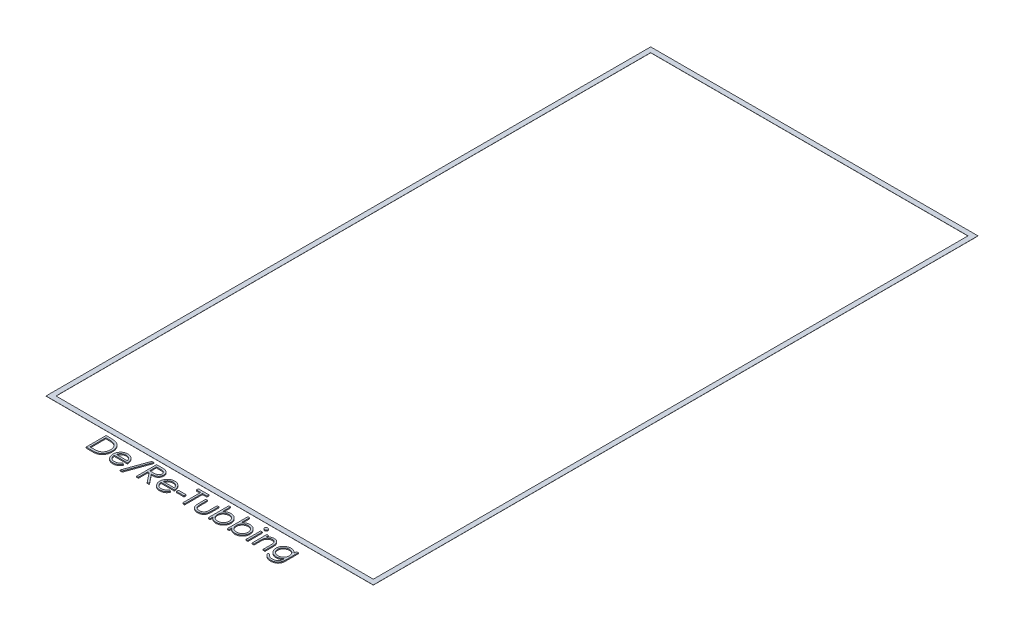
from build123d import *

# Parameters (mm, degrees)
SKETCH1_W              = 655
SKETCH1_H              = 1210
SKETCH1_W_2            = 635
SKETCH1_H_2            = 1190
BOSS_EXTRUDE1_DEPTH    = 0.3
BOSS_EXTRUDE3_DEPTH    = 2
BOSS_EXTRUDE3_2_DEPTH  = 2
BOSS_EXTRUDE3_3_DEPTH  = 2
BOSS_EXTRUDE3_4_DEPTH  = 2
BOSS_EXTRUDE3_5_DEPTH  = 2
SKETCH2_W              = 15.384615384
SKETCH2_H              = 4.102564103
BOSS_EXTRUDE3_6_DEPTH  = 2
BOSS_EXTRUDE3_7_DEPTH  = 2
BOSS_EXTRUDE3_8_DEPTH  = 2
BOSS_EXTRUDE3_9_DEPTH  = 2
BOSS_EXTRUDE3_10_DEPTH = 2
BOSS_EXTRUDE3_11_DEPTH = 2
SKETCH2_W_2            = 3.58974359
SKETCH2_H_2            = 29.23076923
BOSS_EXTRUDE3_12_DEPTH = 2
BOSS_EXTRUDE3_13_DEPTH = 2
BOSS_EXTRUDE3_14_DEPTH = 2


with BuildPart() as part:
    # Sketch1 → Boss-Extrude1 (new body)
    with BuildSketch(Plane(origin=(0, 0, 0), x_dir=(1, 0, 0), z_dir=(0, 1, 0))):
        with Locations((0.165510167, 0.165510167)):
            Rectangle(SKETCH1_W, SKETCH1_H)
        with Locations((0.165510167, 0.165510167)):
            Rectangle(SKETCH1_W_2, SKETCH1_H_2, mode=Mode.SUBTRACT)
    extrude(amount=BOSS_EXTRUDE1_DEPTH)


with BuildPart() as body_2:
    # Sketch2 → Boss-Extrude3 (new body)
    with BuildSketch(Plane(origin=(0, 0, 0), x_dir=(1, 0, 0), z_dir=(0, 1, 0))):
        with BuildLine():
            Line((-197.013977013, -654.834489833), (-197.013977013, -614.834489833))
            Line((-197.013977013, -614.834489833), (-188.937053936, -614.834489833))
            add(Edge.make_bspline(
                [(-188.937053936, -614.834489833), (-188.234551214, -614.839547776), (-186.87731961, -614.849319695), (-184.916034496, -614.911278451), (-183.101362925, -615.020883775), (-181.439273107, -615.180535502), (-179.925202113, -615.376570172), (-178.563389449, -615.622289079), (-177.34679353, -615.912439598), (-176.598571352, -616.159816172), (-176.244746244, -616.276797526)],
                knots=[0, 0, 0, 0, 1.314313732, 2.53924729, 3.670748893, 4.714932338, 5.66265055, 6.526160246, 7.303039223, 8, 8, 8, 8], degree=3))
            add(Edge.make_bspline(
                [(-176.244746244, -616.276797526), (-175.781949223, -616.453148447), (-174.866849883, -616.801851237), (-173.563911339, -617.459637538), (-172.337335762, -618.204930129), (-171.180545535, -619.038711417), (-170.119964662, -619.984589685), (-169.114160128, -621.00238495), (-168.20427757, -622.129108838), (-167.371039901, -623.341394415), (-166.619775222, -624.624960726), (-165.966756275, -625.977361968), (-165.424424922, -627.39173006), (-164.974216618, -628.864131752), (-164.619399961, -630.397804641), (-164.377320741, -631.994534539), (-164.217652286, -633.648010989), (-164.201605985, -634.77000486), (-164.193464192, -635.339297526)],
                knots=[0, 0, 0, 0, 0.984719456, 1.947108742, 2.898477687, 3.838006223, 4.779231079, 5.722358779, 6.681677486, 7.655904652, 8.64651281, 9.637519902, 10.640069247, 11.656948941, 12.698408672, 13.768548281, 14.867775369, 16, 16, 16, 16], degree=3))
            add(Edge.make_bspline(
                [(-164.193464192, -635.339297526), (-164.200652392, -635.83371168), (-164.214817491, -636.808006411), (-164.342009672, -638.24390236), (-164.526881901, -639.637200319), (-164.813101305, -640.981265462), (-165.160558601, -642.287873666), (-165.605863187, -643.543099316), (-166.115983144, -644.758457137), (-166.710838899, -645.917514005), (-167.363883299, -647.015609688), (-168.064703221, -648.050758581), (-168.812551168, -649.008189688), (-169.614558402, -649.890802397), (-170.460360875, -650.69726615), (-171.355496082, -651.434317754), (-172.302273805, -652.087535523), (-173.296453494, -652.682588189), (-174.367037827, -653.201677966), (-175.53430487, -653.640878078), (-176.803232618, -654.004839397), (-178.170706411, -654.308506777), (-179.639089014, -654.549390236), (-181.209820052, -654.710834721), (-182.88048622, -654.820011095), (-184.027677823, -654.829569876), (-184.61814368, -654.834489833)],
                knots=[0, 0, 0, 0, 1.105936401, 2.179363191, 3.223086493, 4.248585256, 5.251745608, 6.245858792, 7.225916811, 8.198733463, 9.158002045, 10.082870192, 10.993790845, 11.873723703, 12.748670949, 13.606408763, 14.465103618, 15.319838547, 16.196477973, 17.123216899, 18.106603292, 19.147568657, 20.255746949, 21.433717677, 22.679120308, 24, 24, 24, 24], degree=3))
            Line((-184.61814368, -654.834489833), (-197.013977013, -654.834489833))
        make_face()
        with BuildLine():
            Line((-193.424233423, -650.731925731), (-188.832887269, -650.731925731))
            add(Edge.make_bspline(
                [(-188.832887269, -650.731925731), (-188.173134461, -650.729090344), (-186.904188193, -650.723636856), (-185.079525367, -650.675783106), (-183.412332265, -650.597589534), (-181.902372157, -650.488160074), (-180.550497594, -650.3433759), (-179.353883309, -650.18194844), (-178.316451786, -649.980834717), (-177.688686792, -649.798538038), (-177.398592397, -649.714297526)],
                knots=[0, 0, 0, 0, 1.375205317, 2.645023457, 3.804390687, 4.853969522, 5.800190428, 6.637939096, 7.370582563, 8, 8, 8, 8], degree=3))
            add(Edge.make_bspline(
                [(-177.398592397, -649.714297526), (-177.033468259, -649.585708289), (-176.311940966, -649.331601166), (-175.273299992, -648.868085038), (-174.30464851, -648.319032812), (-173.389105364, -647.70872111), (-172.539657874, -647.015623944), (-171.746239401, -646.254812643), (-171.010447386, -645.422415214), (-170.339883866, -644.519464796), (-169.739788963, -643.551581417), (-169.22011777, -642.528280461), (-168.764671694, -641.460774058), (-168.407202064, -640.332669388), (-168.127023959, -639.154051577), (-167.928570383, -637.924837712), (-167.804973532, -636.645257348), (-167.790556984, -635.774947356), (-167.783207782, -635.331284705)],
                knots=[0, 0, 0, 0, 0.998632004, 1.973411704, 2.929992603, 3.868527914, 4.809262121, 5.754881198, 6.702106254, 7.672490631, 8.653608572, 9.636854334, 10.631411391, 11.644891563, 12.686317036, 13.754757253, 14.855430412, 16, 16, 16, 16], degree=3))
            add(Edge.make_bspline(
                [(-167.783207782, -635.331284705), (-167.789073923, -634.863473502), (-167.80059801, -633.944454252), (-167.945447272, -632.595989163), (-168.157122192, -631.299067443), (-168.463221461, -630.053602353), (-168.853288648, -628.857164042), (-169.340084553, -627.71636964), (-169.896274488, -626.619171138), (-170.558026909, -625.590892673), (-171.282776547, -624.618399997), (-172.087095168, -623.727486676), (-172.95820418, -622.916123244), (-173.88660246, -622.171673957), (-174.898455022, -621.524089089), (-175.969925774, -620.944812734), (-177.116733445, -620.453202547), (-177.914592826, -620.19172983), (-178.320066756, -620.058848808)],
                knots=[0, 0, 0, 0, 1.122418816, 2.205001699, 3.251619955, 4.274784885, 5.280384055, 6.268708349, 7.249350384, 8.229342522, 9.199999885, 10.157847722, 11.105861043, 12.055065948, 13.010012805, 13.98527497, 14.976112212, 16, 16, 16, 16], degree=3))
            add(Edge.make_bspline(
                [(-178.320066756, -620.058848808), (-178.655508429, -619.966089632), (-179.368749461, -619.768858174), (-180.53262905, -619.55371106), (-181.842516472, -619.363945357), (-183.304227342, -619.20328205), (-184.916095446, -619.087998377), (-186.679360451, -619.001469067), (-188.594784504, -618.943107553), (-189.92258489, -618.939122328), (-190.611733423, -618.937053936)],
                knots=[0, 0, 0, 0, 0.674548936, 1.434276114, 2.292660221, 3.240891867, 4.284742987, 5.42552168, 6.663806718, 8, 8, 8, 8], degree=3))
            Line((-190.611733423, -618.937053936), (-193.424233423, -618.937053936))
            Line((-193.424233423, -618.937053936), (-193.424233423, -650.731925731))
        make_face(mode=Mode.SUBTRACT)
    extrude(amount=BOSS_EXTRUDE3_DEPTH)


with BuildPart() as body_3:
    # Sketch2 → Boss-Extrude3 2 (new body)
    with BuildSketch(Plane(origin=(0, 0, 0), x_dir=(1, 0, 0), z_dir=(0, 1, 0))):
        with BuildLine():
            Line((-133.023592397, -645.603720603), (-129.834489833, -647.27840009))
            add(Edge.make_bspline(
                [(-129.834489833, -647.27840009), (-130.08862235, -647.729181019), (-130.58306359, -648.606222194), (-131.433357852, -649.811157742), (-132.324695824, -650.895131637), (-133.297312601, -651.829184829), (-134.322108932, -652.643486372), (-135.404767844, -653.355918654), (-136.550925761, -653.962987458), (-137.760636901, -654.474444919), (-139.044060343, -654.867696281), (-140.404306245, -655.145458806), (-141.843980478, -655.317153304), (-142.830793962, -655.33709777), (-143.336092397, -655.347310346)],
                knots=[0, 0, 0, 0, 1.120438281, 2.179929193, 3.190490725, 4.156257408, 5.095198341, 6.022838206, 6.959905092, 7.901321166, 8.864066838, 9.862729781, 10.905609505, 12, 12, 12, 12], degree=3))
            add(Edge.make_bspline(
                [(-143.336092397, -655.347310346), (-143.897714998, -655.334199771), (-144.993277988, -655.308624837), (-146.588017955, -655.088139529), (-148.089497023, -654.72845543), (-149.497630775, -654.225992098), (-150.808970805, -653.569679823), (-152.026123431, -652.770142888), (-153.155489441, -651.831488549), (-154.161480403, -650.745586338), (-155.067124777, -649.583506826), (-155.866277005, -648.372582432), (-156.534361932, -647.115859866), (-157.077820334, -645.821339591), (-157.516733076, -644.497180808), (-157.822638262, -643.131335464), (-157.998978239, -641.727500216), (-158.026000474, -640.777816379), (-158.039618038, -640.299233423)],
                knots=[0, 0, 0, 0, 1.145258523, 2.234067595, 3.276747158, 4.290159414, 5.277019952, 6.260822364, 7.254936242, 8.264827045, 9.274100331, 10.257902744, 11.220704747, 12.172965371, 13.118907548, 14.062713208, 15.023725156, 16, 16, 16, 16], degree=3))
            add(Edge.make_bspline(
                [(-158.039618038, -640.299233423), (-158.027513566, -639.850149647), (-158.0035241, -638.960124908), (-157.852315102, -637.642804399), (-157.584334609, -636.362479227), (-157.216605193, -635.118085536), (-156.741733808, -633.911706862), (-156.16079416, -632.742608992), (-155.472881271, -631.612035965), (-154.941764999, -630.898857294), (-154.674233423, -630.539618038)],
                knots=[0, 0, 0, 0, 1.024358464, 2.0301432, 3.019427413, 4.004406732, 4.986367066, 5.972626655, 6.978780325, 8, 8, 8, 8], degree=3))
            add(Edge.make_bspline(
                [(-154.674233423, -630.539618038), (-154.311859906, -630.106830952), (-153.598591944, -629.254966375), (-152.392233598, -628.135671223), (-151.085945639, -627.198028079), (-149.696098484, -626.420803666), (-148.20653878, -625.8302477), (-146.63728974, -625.390161046), (-144.97048304, -625.143555205), (-143.830994802, -625.108722821), (-143.247951372, -625.09090009)],
                knots=[0, 0, 0, 0, 1.030682036, 2.02871468, 2.997146059, 3.962720338, 4.930598197, 5.918074684, 6.934738563, 8, 8, 8, 8], degree=3))
            add(Edge.make_bspline(
                [(-143.247951372, -625.09090009), (-142.648550168, -625.106374934), (-141.472661643, -625.136733052), (-139.758008831, -625.418176862), (-138.135600642, -625.864491771), (-136.606086307, -626.494820806), (-135.169310756, -627.308072826), (-133.834613047, -628.315408157), (-132.579167189, -629.485900583), (-131.848783431, -630.386051548), (-131.477118038, -630.844105218)],
                knots=[0, 0, 0, 0, 1.056321875, 2.072262726, 3.055038591, 4.01806755, 4.982017516, 5.957941055, 6.960871419, 8, 8, 8, 8], degree=3))
            add(Edge.make_bspline(
                [(-131.477118038, -630.844105218), (-131.224238743, -631.189289005), (-130.720163394, -631.877358933), (-130.088767965, -632.999315014), (-129.540683451, -634.173150378), (-129.102592468, -635.417839488), (-128.747855311, -636.71863469), (-128.491205954, -638.084835201), (-128.340696027, -639.516034188), (-128.311110915, -640.491194822), (-128.296028295, -640.988335987)],
                knots=[0, 0, 0, 0, 0.94817472, 1.890038105, 2.849395472, 3.817997239, 4.812318967, 5.836947057, 6.897266129, 8, 8, 8, 8], degree=3))
            Line((-128.296028295, -640.988335987), (-154.449874449, -640.988335987))
            add(Edge.make_bspline(
                [(-154.449874449, -640.988335987), (-154.432278947, -641.37348415), (-154.397678102, -642.130862479), (-154.23636218, -643.2391), (-153.982090479, -644.294795339), (-153.624729764, -645.290030104), (-153.191965818, -646.23780299), (-152.66184334, -647.131083412), (-152.029391295, -647.965802613), (-151.323954731, -648.749427043), (-150.538730784, -649.447264313), (-149.712642244, -650.071856041), (-148.833858644, -650.595348575), (-147.909309119, -651.020261601), (-146.940488717, -651.352905213), (-145.927092201, -651.579966021), (-144.871113729, -651.732047243), (-144.151276768, -651.748957702), (-143.784810346, -651.757566756)],
                knots=[0, 0, 0, 0, 1.094153842, 2.151609401, 3.174256925, 4.172055639, 5.149267565, 6.128595816, 7.11444997, 8.118368179, 9.117203808, 10.09244225, 11.054858984, 12.015122123, 12.976791628, 13.957293641, 14.960065497, 16, 16, 16, 16], degree=3))
            add(Edge.make_bspline(
                [(-143.784810346, -651.757566756), (-143.426511516, -651.750617537), (-142.715577906, -651.736828954), (-141.65682525, -651.602749972), (-140.615230652, -651.385946822), (-139.595105129, -651.090061221), (-138.617152604, -650.729182911), (-137.711489175, -650.293721681), (-136.878572425, -649.81201029), (-136.100092806, -649.261042575), (-135.34499574, -648.586663295), (-134.595938752, -647.745112198), (-133.792776999, -646.749826166), (-133.290038796, -646.000732841), (-133.023592397, -645.603720603)],
                knots=[0, 0, 0, 0, 0.99110716, 1.966546729, 2.947904876, 3.932708344, 4.903319531, 5.828989031, 6.710028674, 7.56322171, 8.463672341, 9.504779593, 10.677557249, 12, 12, 12, 12], degree=3))
        make_face()
        with BuildLine():
            add(Edge.make_bspline(
                [(-131.885771885, -637.398592397), (-132.01716188, -636.922445269), (-132.270045325, -636.00601532), (-132.798460919, -634.736976572), (-133.393564241, -633.609114846), (-134.0978126, -632.631061897), (-134.895740892, -631.76245032), (-135.817400123, -631.003380775), (-136.850953191, -630.324324191), (-137.991057656, -629.751152769), (-139.198392343, -629.263268669), (-140.462463108, -628.936124489), (-141.752266398, -628.712015434), (-142.624658242, -628.691145624), (-143.0636565, -628.68064368)],
                knots=[0, 0, 0, 0, 1.154881502, 2.222775134, 3.210006277, 4.132804581, 5.035138423, 5.962687519, 6.919655026, 7.923214229, 8.944639381, 9.960483929, 10.97369054, 12, 12, 12, 12], degree=3))
            add(Edge.make_bspline(
                [(-143.0636565, -628.68064368), (-143.421935797, -628.687634211), (-144.130178644, -628.701453023), (-145.173619423, -628.832540216), (-146.175673125, -629.049224157), (-147.143733555, -629.345966518), (-148.065114908, -629.741493404), (-148.958769402, -630.205301708), (-149.80197393, -630.771491237), (-150.329303021, -631.203021007), (-150.595707782, -631.421028295)],
                knots=[0, 0, 0, 0, 1.04873581, 2.073130211, 3.073294108, 4.04793562, 5.032784715, 6.005352987, 6.992311501, 8, 8, 8, 8], degree=3))
            add(Edge.make_bspline(
                [(-150.595707782, -631.421028295), (-150.786488147, -631.593534759), (-151.17258111, -631.9426458), (-151.688472784, -632.544122446), (-152.182421043, -633.192711728), (-152.631948503, -633.913227438), (-153.044263777, -634.697464912), (-153.430092088, -635.538809315), (-153.777365369, -636.443645089), (-153.972749484, -637.074187252), (-154.073271885, -637.398592397)],
                knots=[0, 0, 0, 0, 0.879870761, 1.780643979, 2.707998968, 3.669668524, 4.684282772, 5.740141944, 6.837334558, 8, 8, 8, 8], degree=3))
            Line((-154.073271885, -637.398592397), (-131.885771885, -637.398592397))
        make_face(mode=Mode.SUBTRACT)
    extrude(amount=BOSS_EXTRUDE3_2_DEPTH)


with BuildPart() as body_4:
    # Sketch2 → Boss-Extrude3 3 (new body)
    with BuildSketch(Plane(origin=(0, 0, 0), x_dir=(1, 0, 0), z_dir=(0, 1, 0))):
        Polygon((-102.655002654, -613.808848808), (-119.385771885, -660.475515474), (-123.167823167, -660.475515474), (-106.437053936, -613.808848808), align=None)
    extrude(amount=BOSS_EXTRUDE3_3_DEPTH)


with BuildPart() as body_5:
    # Sketch2 → Boss-Extrude3 4 (new body)
    with BuildSketch(Plane(origin=(0, 0, 0), x_dir=(1, 0, 0), z_dir=(0, 1, 0))):
        with BuildLine():
            Line((-95.988335987, -614.834489833), (-87.983528295, -614.834489833))
            add(Edge.make_bspline(
                [(-87.983528295, -614.834489833), (-87.449343969, -614.836267959), (-86.42365089, -614.839682157), (-84.954242086, -614.858719447), (-83.619075263, -614.913283513), (-82.418848528, -614.960238752), (-81.3535839, -615.045860939), (-80.420014863, -615.127696906), (-79.622441177, -615.234824458), (-79.139631448, -615.334315006), (-78.921028295, -615.379361628)],
                knots=[0, 0, 0, 0, 1.410062039, 2.707475311, 3.878576406, 4.937260626, 5.877586885, 6.699081471, 7.410979367, 8, 8, 8, 8], degree=3))
            add(Edge.make_bspline(
                [(-78.921028295, -615.379361628), (-78.628381162, -615.451667518), (-78.049329854, -615.594736817), (-77.215614813, -615.897132255), (-76.421165397, -616.247070822), (-75.66928169, -616.658084769), (-74.963729791, -617.133225108), (-74.29723481, -617.664289364), (-73.666772372, -618.248371716), (-73.097839455, -618.900198476), (-72.56139315, -619.584044301), (-72.108951704, -620.323515807), (-71.718934793, -621.096790408), (-71.408414599, -621.911732325), (-71.158380617, -622.760438289), (-70.982080738, -623.650595966), (-70.876352879, -624.578149967), (-70.865588816, -625.210811782), (-70.860130859, -625.531605218)],
                knots=[0, 0, 0, 0, 1.027469482, 2.033020251, 3.019912614, 3.986113645, 4.951240523, 5.91722682, 6.890402269, 7.87763091, 8.8651537, 9.85103654, 10.82876324, 11.815024772, 12.821070561, 13.842952187, 14.906261191, 16, 16, 16, 16], degree=3))
            add(Edge.make_bspline(
                [(-70.860130859, -625.531605218), (-70.876919409, -626.064577842), (-70.909678218, -627.104545475), (-71.215107974, -628.613812691), (-71.715411057, -630.021690573), (-72.404820074, -631.326406435), (-73.282756939, -632.502528096), (-74.337897409, -633.535561871), (-75.570830112, -634.400018015), (-76.718593723, -634.99947864), (-77.732470291, -635.383397596), (-78.567136722, -635.653527411), (-79.477616465, -635.862235586), (-80.455186004, -636.04920852), (-81.503913495, -636.190370742), (-82.621285374, -636.293760393), (-83.808098535, -636.358378093), (-84.623402185, -636.368001006), (-85.042823167, -636.372951372)],
                knots=[0, 0, 0, 0, 1.260483769, 2.459530307, 3.627416485, 4.787058657, 5.939039949, 7.08810263, 8.267026773, 9.491475466, 10.141966685, 10.831826277, 11.566392101, 12.351337768, 13.187381173, 14.07005841, 15.007169909, 16, 16, 16, 16], degree=3))
            Line((-85.042823167, -636.372951372), (-70.347310346, -654.834489833))
            Line((-70.347310346, -654.834489833), (-74.78641291, -654.834489833))
            Line((-74.78641291, -654.834489833), (-89.481925731, -636.372951372))
            Line((-89.481925731, -636.372951372), (-92.398592397, -636.372951372))
            Line((-92.398592397, -636.372951372), (-92.398592397, -654.834489833))
            Line((-92.398592397, -654.834489833), (-95.988335987, -654.834489833))
            Line((-95.988335987, -654.834489833), (-95.988335987, -614.834489833))
        make_face()
        with BuildLine():
            Line((-92.398592397, -618.937053936), (-92.398592397, -632.270387269))
            Line((-92.398592397, -632.270387269), (-85.074874449, -632.326477013))
            add(Edge.make_bspline(
                [(-85.074874449, -632.326477013), (-84.732931147, -632.326628289), (-84.070147637, -632.326921505), (-83.111282896, -632.281278348), (-82.21848162, -632.229354711), (-81.395158738, -632.149933619), (-80.640946448, -632.047578514), (-79.956221726, -631.919544408), (-79.339866847, -631.770377978), (-78.621026408, -631.539502254), (-77.818323192, -631.173719188), (-76.945963651, -630.64154206), (-76.203079791, -629.972180698), (-75.575447079, -629.206769772), (-75.071110719, -628.365212643), (-74.715544384, -627.457596995), (-74.489916472, -626.506835874), (-74.463304524, -625.853371785), (-74.449874449, -625.523592397)],
                knots=[0, 0, 0, 0, 1.146690395, 2.22261258, 3.21895312, 4.145990853, 4.996080663, 5.770904154, 6.481378293, 7.121626537, 8.300444488, 9.431385265, 10.535395872, 11.636531494, 12.74115979, 13.810798291, 14.895190096, 16, 16, 16, 16], degree=3))
            add(Edge.make_bspline(
                [(-74.449874449, -625.523592397), (-74.463612975, -625.201917269), (-74.490837722, -624.564474541), (-74.713109363, -623.631264138), (-75.088988007, -622.750498994), (-75.595527869, -621.925762022), (-76.212661068, -621.177125041), (-76.936293213, -620.536586149), (-77.746638301, -620.008020839), (-78.504023425, -619.67025649), (-79.180985853, -619.463172453), (-79.768753397, -619.317444866), (-80.432884571, -619.200365221), (-81.176604098, -619.106558811), (-81.996737021, -619.025930877), (-82.897430176, -618.971624835), (-83.872707665, -618.939466388), (-84.548672593, -618.937876801), (-84.898592397, -618.937053936)],
                knots=[0, 0, 0, 0, 1.101028733, 2.181837193, 3.264309656, 4.369019818, 5.486613113, 6.575447106, 7.666700264, 8.788928104, 9.402425223, 10.0903467, 10.862060571, 11.710948788, 12.657782767, 13.684531032, 14.801375019, 16, 16, 16, 16], degree=3))
            Line((-84.898592397, -618.937053936), (-92.398592397, -618.937053936))
        make_face(mode=Mode.SUBTRACT)
    extrude(amount=BOSS_EXTRUDE3_4_DEPTH)


with BuildPart() as body_6:
    # Sketch2 → Boss-Extrude3 5 (new body)
    with BuildSketch(Plane(origin=(0, 0, 0), x_dir=(1, 0, 0), z_dir=(0, 1, 0))):
        with BuildLine():
            Line((-39.177438551, -645.603720603), (-35.988335987, -647.27840009))
            add(Edge.make_bspline(
                [(-35.988335987, -647.27840009), (-36.242468504, -647.729181019), (-36.736909744, -648.606222194), (-37.587204006, -649.811157742), (-38.478541978, -650.895131637), (-39.451158755, -651.829184829), (-40.475955086, -652.643486372), (-41.558613998, -653.355918654), (-42.704771915, -653.962987458), (-43.914483055, -654.474444919), (-45.197906497, -654.867696281), (-46.558152399, -655.145458806), (-47.997826632, -655.317153304), (-48.984640116, -655.33709777), (-49.489938551, -655.347310346)],
                knots=[0, 0, 0, 0, 1.120438281, 2.179929193, 3.190490725, 4.156257408, 5.095198341, 6.022838206, 6.959905092, 7.901321166, 8.864066838, 9.862729781, 10.905609505, 12, 12, 12, 12], degree=3))
            add(Edge.make_bspline(
                [(-49.489938551, -655.347310346), (-50.051561152, -655.334199771), (-51.147124142, -655.308624837), (-52.741864109, -655.088139529), (-54.243343176, -654.72845543), (-55.651476929, -654.225992098), (-56.962816959, -653.569679823), (-58.179969585, -652.770142888), (-59.309335595, -651.831488549), (-60.315326557, -650.745586338), (-61.220970931, -649.583506826), (-62.020123159, -648.372582432), (-62.688208085, -647.115859866), (-63.231666488, -645.821339591), (-63.67057923, -644.497180808), (-63.976484416, -643.131335464), (-64.152824393, -641.727500216), (-64.179846628, -640.777816379), (-64.193464192, -640.299233423)],
                knots=[0, 0, 0, 0, 1.145258523, 2.234067595, 3.276747158, 4.290159414, 5.277019952, 6.260822364, 7.254936242, 8.264827045, 9.274100331, 10.257902744, 11.220704747, 12.172965371, 13.118907548, 14.062713208, 15.023725156, 16, 16, 16, 16], degree=3))
            add(Edge.make_bspline(
                [(-64.193464192, -640.299233423), (-64.18135972, -639.850149647), (-64.157370254, -638.960124908), (-64.006161255, -637.642804399), (-63.738180763, -636.362479227), (-63.370451347, -635.118085536), (-62.895579962, -633.911706862), (-62.314640314, -632.742608992), (-61.626727425, -631.612035965), (-61.095611153, -630.898857294), (-60.828079577, -630.539618038)],
                knots=[0, 0, 0, 0, 1.024358464, 2.0301432, 3.019427413, 4.004406732, 4.986367066, 5.972626655, 6.978780325, 8, 8, 8, 8], degree=3))
            add(Edge.make_bspline(
                [(-60.828079577, -630.539618038), (-60.46570606, -630.106830952), (-59.752438098, -629.254966375), (-58.546079751, -628.135671223), (-57.239791793, -627.198028079), (-55.849944638, -626.420803666), (-54.360384934, -625.8302477), (-52.791135894, -625.390161046), (-51.124329194, -625.143555205), (-49.984840956, -625.108722821), (-49.401797526, -625.09090009)],
                knots=[0, 0, 0, 0, 1.030682036, 2.02871468, 2.997146059, 3.962720338, 4.930598197, 5.918074684, 6.934738563, 8, 8, 8, 8], degree=3))
            add(Edge.make_bspline(
                [(-49.401797526, -625.09090009), (-48.802396322, -625.106374934), (-47.626507797, -625.136733052), (-45.911854985, -625.418176862), (-44.289446796, -625.864491771), (-42.759932461, -626.494820806), (-41.32315691, -627.308072826), (-39.9884592, -628.315408157), (-38.733013343, -629.485900583), (-38.002629584, -630.386051548), (-37.630964192, -630.844105218)],
                knots=[0, 0, 0, 0, 1.056321875, 2.072262726, 3.055038591, 4.01806755, 4.982017516, 5.957941055, 6.960871419, 8, 8, 8, 8], degree=3))
            add(Edge.make_bspline(
                [(-37.630964192, -630.844105218), (-37.378084897, -631.189289005), (-36.874009548, -631.877358933), (-36.242614119, -632.999315014), (-35.694529605, -634.173150378), (-35.256438622, -635.417839488), (-34.901701465, -636.71863469), (-34.645052108, -638.084835201), (-34.494542181, -639.516034188), (-34.464957069, -640.491194822), (-34.449874449, -640.988335987)],
                knots=[0, 0, 0, 0, 0.94817472, 1.890038105, 2.849395472, 3.817997239, 4.812318967, 5.836947057, 6.897266129, 8, 8, 8, 8], degree=3))
            Line((-34.449874449, -640.988335987), (-60.603720603, -640.988335987))
            add(Edge.make_bspline(
                [(-60.603720603, -640.988335987), (-60.586125101, -641.37348415), (-60.551524255, -642.130862479), (-60.390208334, -643.2391), (-60.135936633, -644.294795339), (-59.778575917, -645.290030104), (-59.345811972, -646.23780299), (-58.815689494, -647.131083412), (-58.183237449, -647.965802613), (-57.477800884, -648.749427043), (-56.692576938, -649.447264313), (-55.866488398, -650.071856041), (-54.987704798, -650.595348575), (-54.063155273, -651.020261601), (-53.094334871, -651.352905213), (-52.080938355, -651.579966021), (-51.024959883, -651.732047243), (-50.305122922, -651.748957702), (-49.9386565, -651.757566756)],
                knots=[0, 0, 0, 0, 1.094153842, 2.151609401, 3.174256925, 4.172055639, 5.149267565, 6.128595816, 7.11444997, 8.118368179, 9.117203808, 10.09244225, 11.054858984, 12.015122123, 12.976791628, 13.957293641, 14.960065497, 16, 16, 16, 16], degree=3))
            add(Edge.make_bspline(
                [(-49.9386565, -651.757566756), (-49.58035767, -651.750617537), (-48.86942406, -651.736828954), (-47.810671404, -651.602749972), (-46.769076805, -651.385946822), (-45.748951282, -651.090061221), (-44.770998758, -650.729182911), (-43.865335328, -650.293721681), (-43.032418578, -649.81201029), (-42.25393896, -649.261042575), (-41.498841893, -648.586663295), (-40.749784906, -647.745112198), (-39.946623153, -646.749826166), (-39.44388495, -646.000732841), (-39.177438551, -645.603720603)],
                knots=[0, 0, 0, 0, 0.99110716, 1.966546729, 2.947904876, 3.932708344, 4.903319531, 5.828989031, 6.710028674, 7.56322171, 8.463672341, 9.504779593, 10.677557249, 12, 12, 12, 12], degree=3))
        make_face()
        with BuildLine():
            add(Edge.make_bspline(
                [(-38.039618038, -637.398592397), (-38.171008033, -636.922445269), (-38.423891479, -636.00601532), (-38.952307073, -634.736976572), (-39.547410395, -633.609114846), (-40.251658753, -632.631061897), (-41.049587046, -631.76245032), (-41.971246277, -631.003380775), (-43.004799345, -630.324324191), (-44.14490381, -629.751152769), (-45.352238497, -629.263268669), (-46.616309262, -628.936124489), (-47.906112552, -628.712015434), (-48.778504396, -628.691145624), (-49.217502654, -628.68064368)],
                knots=[0, 0, 0, 0, 1.154881502, 2.222775134, 3.210006277, 4.132804581, 5.035138423, 5.962687519, 6.919655026, 7.923214229, 8.944639381, 9.960483929, 10.97369054, 12, 12, 12, 12], degree=3))
            add(Edge.make_bspline(
                [(-49.217502654, -628.68064368), (-49.575781951, -628.687634211), (-50.284024798, -628.701453023), (-51.327465577, -628.832540216), (-52.329519279, -629.049224157), (-53.297579709, -629.345966518), (-54.218961061, -629.741493404), (-55.112615555, -630.205301708), (-55.955820084, -630.771491237), (-56.483149175, -631.203021007), (-56.749553936, -631.421028295)],
                knots=[0, 0, 0, 0, 1.04873581, 2.073130211, 3.073294108, 4.04793562, 5.032784715, 6.005352987, 6.992311501, 8, 8, 8, 8], degree=3))
            add(Edge.make_bspline(
                [(-56.749553936, -631.421028295), (-56.940334301, -631.593534759), (-57.326427264, -631.9426458), (-57.842318938, -632.544122446), (-58.336267197, -633.192711728), (-58.785794657, -633.913227438), (-59.198109931, -634.697464912), (-59.583938242, -635.538809315), (-59.931211523, -636.443645089), (-60.126595637, -637.074187252), (-60.227118038, -637.398592397)],
                knots=[0, 0, 0, 0, 0.879870761, 1.780643979, 2.707998968, 3.669668524, 4.684282772, 5.740141944, 6.837334558, 8, 8, 8, 8], degree=3))
            Line((-60.227118038, -637.398592397), (-38.039618038, -637.398592397))
        make_face(mode=Mode.SUBTRACT)
    extrude(amount=BOSS_EXTRUDE3_5_DEPTH)


with BuildPart() as body_7:
    # Sketch2 → Boss-Extrude3 6 (new body)
    with BuildSketch(Plane(origin=(0, 0, 0), x_dir=(1, 0, 0), z_dir=(0, 1, 0))):
        with Locations((-22.142182141, -639.449874449)):
            Rectangle(SKETCH2_W, SKETCH2_H)
    extrude(amount=BOSS_EXTRUDE3_6_DEPTH)


with BuildPart() as body_8:
    # Sketch2 → Boss-Extrude3 7 (new body)
    with BuildSketch(Plane(origin=(0, 0, 0), x_dir=(1, 0, 0), z_dir=(0, 1, 0))):
        Polygon((-12.398592397, -618.937053936), (-12.398592397, -614.834489833), (8.627048628, -614.834489833), (8.627048628, -618.937053936), (-0.09090009, -618.937053936), (-0.09090009, -654.834489833), (-3.68064368, -654.834489833), (-3.68064368, -618.937053936), align=None)
    extrude(amount=BOSS_EXTRUDE3_7_DEPTH)


with BuildPart() as body_9:
    # Sketch2 → Boss-Extrude3 8 (new body)
    with BuildSketch(Plane(origin=(0, 0, 0), x_dir=(1, 0, 0), z_dir=(0, 1, 0))):
        with BuildLine():
            Line((13.242433244, -625.603720603), (16.832176833, -625.603720603))
            Line((16.832176833, -625.603720603), (16.832176833, -639.16141291))
            add(Edge.make_bspline(
                [(16.832176833, -639.16141291), (16.833798604, -639.559387187), (16.836900974, -640.320693336), (16.857940299, -641.416181184), (16.907427084, -642.415229329), (16.969299364, -643.318414892), (17.048866634, -644.125585081), (17.143533611, -644.83392059), (17.249344144, -645.451454123), (17.352918017, -645.823378188), (17.40108709, -645.996348808)],
                knots=[0, 0, 0, 0, 1.388932606, 2.656963016, 3.823490214, 4.879454478, 5.816252168, 6.653371382, 7.373723809, 8, 8, 8, 8], degree=3))
            add(Edge.make_bspline(
                [(17.40108709, -645.996348808), (17.478360861, -646.213753047), (17.631301901, -646.644041746), (17.908713144, -647.265630376), (18.251894134, -647.84134789), (18.627435024, -648.393394435), (19.060571111, -648.905417142), (19.545822209, -649.376551356), (20.066944918, -649.824598113), (20.841288042, -650.354710021), (21.900251082, -650.922885223), (23.290568286, -651.413123147), (24.798045153, -651.706103947), (25.839927659, -651.740095433), (26.375446064, -651.757566756)],
                knots=[0, 0, 0, 0, 0.725840625, 1.436591201, 2.137033971, 2.831655856, 3.53531722, 4.242432219, 4.957935707, 5.694543706, 7.190802206, 8.724350549, 10.316345118, 12, 12, 12, 12], degree=3))
            add(Edge.make_bspline(
                [(26.375446064, -651.757566756), (26.910914724, -651.739723915), (27.946947504, -651.705201319), (29.437861439, -651.421960878), (30.800734747, -650.948753003), (32.021888476, -650.288096869), (33.095783792, -649.479616151), (33.990691435, -648.530944051), (34.729060058, -647.472093915), (35.051453437, -646.682102157), (35.21358709, -646.284810346)],
                knots=[0, 0, 0, 0, 1.157059328, 2.238695713, 3.266970494, 4.264342957, 5.228770407, 6.160125903, 7.074715775, 8, 8, 8, 8], degree=3))
            add(Edge.make_bspline(
                [(35.21358709, -646.284810346), (35.261521148, -646.125195504), (35.367491643, -645.772326071), (35.481347089, -645.173700375), (35.583912364, -644.45981918), (35.67149152, -643.626011081), (35.733950521, -642.674455053), (35.767619397, -641.605448469), (35.805656828, -640.42234721), (35.806234157, -639.594144246), (35.806535808, -639.16141291)],
                knots=[0, 0, 0, 0, 0.557542046, 1.232589297, 2.036731608, 2.971723315, 4.038036528, 5.22795436, 6.551621927, 8, 8, 8, 8], degree=3))
            Line((35.806535808, -639.16141291), (35.806535808, -625.603720603))
            Line((35.806535808, -625.603720603), (39.396279397, -625.603720603))
            Line((39.396279397, -625.603720603), (39.396279397, -639.834489833))
            add(Edge.make_bspline(
                [(39.396279397, -639.834489833), (39.391231457, -640.318000364), (39.381437761, -641.256076934), (39.318496693, -642.619323923), (39.210501119, -643.889749579), (39.04658472, -645.068026377), (38.853834153, -646.15325474), (38.605191033, -647.146825551), (38.308296887, -648.045677596), (37.973376716, -648.865583618), (37.57769823, -649.608976695), (37.156817996, -650.314528884), (36.670820603, -650.964733858), (36.159160783, -651.591958283), (35.589999002, -652.16500431), (34.974000614, -652.697021177), (34.319835815, -653.19614154), (33.612987838, -653.642899019), (32.863775691, -654.045374966), (32.071274468, -654.402130144), (31.225777345, -654.684445311), (30.338192923, -654.927995776), (29.404172587, -655.119018281), (28.424616781, -655.253721901), (27.399855452, -655.336297111), (26.701461627, -655.343577624), (26.343394782, -655.347310346)],
                knots=[0, 0, 0, 0, 1.493040784, 2.896703357, 4.213163133, 5.428574705, 6.569057535, 7.615249723, 8.588095153, 9.490268104, 10.346124644, 11.18633936, 12.024365274, 12.850166724, 13.684164916, 14.514361689, 15.362232829, 16.222528818, 17.093394965, 17.986930858, 18.902426812, 19.842810585, 20.827885679, 21.843828298, 22.894529745, 24, 24, 24, 24], degree=3))
            add(Edge.make_bspline(
                [(26.343394782, -655.347310346), (25.988006049, -655.343427979), (25.289634106, -655.335798766), (24.264819886, -655.254178106), (23.282550099, -655.119227584), (22.346316973, -654.926596528), (21.455181004, -654.686150015), (20.605532548, -654.400395324), (19.8073204, -654.045189818), (19.05095464, -653.645446304), (18.342355917, -653.193271728), (17.678257882, -652.697636989), (17.059550996, -652.159281983), (16.48609879, -651.580455044), (15.965950486, -650.953975771), (15.492624296, -650.284883654), (15.05883338, -649.579808356), (14.666230061, -648.824800785), (14.328952855, -647.995406387), (14.031178616, -647.077725278), (13.787628463, -646.061696514), (13.589428825, -644.94818876), (13.429983789, -643.742531142), (13.319285021, -642.437749253), (13.257389813, -641.037021343), (13.247526253, -640.069594028), (13.242433244, -639.570066756)],
                knots=[0, 0, 0, 0, 1.083640291, 2.129454052, 3.13281866, 4.105697902, 5.042300162, 5.946461698, 6.836384745, 7.703652036, 8.553297018, 9.397182691, 10.228592656, 11.052265423, 11.879314572, 12.708807002, 13.549817954, 14.402308542, 15.300838682, 16.27712199, 17.341985831, 18.484375296, 19.725102775, 21.0496083, 22.476576903, 24, 24, 24, 24], degree=3))
            Line((13.242433244, -639.570066756), (13.242433244, -625.603720603))
        make_face()
    extrude(amount=BOSS_EXTRUDE3_8_DEPTH)


with BuildPart() as body_10:
    # Sketch2 → Boss-Extrude3 9 (new body)
    with BuildSketch(Plane(origin=(0, 0, 0), x_dir=(1, 0, 0), z_dir=(0, 1, 0))):
        with BuildLine():
            Line((47.601407603, -654.834489833), (47.601407603, -613.808848808))
            Line((47.601407603, -613.808848808), (51.191151192, -613.808848808))
            Line((51.191151192, -613.808848808), (51.191151192, -630.908207782))
            add(Edge.make_bspline(
                [(51.191151192, -630.908207782), (51.595647409, -630.442402846), (52.384836203, -629.533598215), (53.707995646, -628.346767931), (55.09548787, -627.340453904), (56.557867936, -626.510898264), (58.097215743, -625.879199899), (59.7055827, -625.417229729), (61.387080308, -625.138522266), (62.533585153, -625.10691), (63.114228115, -625.09090009)],
                knots=[0, 0, 0, 0, 1.077089805, 2.101446609, 3.097517232, 4.067117542, 5.031729543, 5.997785507, 6.985986182, 8, 8, 8, 8], degree=3))
            add(Edge.make_bspline(
                [(63.114228115, -625.09090009), (63.630412547, -625.105074126), (64.65099714, -625.133098612), (66.151364537, -625.346064273), (67.594944825, -625.691410581), (68.980952228, -626.170178344), (70.302919457, -626.805412371), (71.572165823, -627.565884459), (72.782188503, -628.471465364), (73.914244337, -629.50687463), (74.957603037, -630.630950318), (75.870888867, -631.833011064), (76.642313966, -633.095583526), (77.280385882, -634.414441383), (77.773769343, -635.794971109), (78.113680969, -637.235819094), (78.329606274, -638.735567878), (78.356809089, -639.756285633), (78.370638372, -640.275194962)],
                knots=[0, 0, 0, 0, 1.034377878, 2.045141349, 3.03070803, 4.00595497, 4.978199603, 5.965204761, 6.967410914, 8.002051993, 9.036360596, 10.037508045, 11.022711142, 11.997267194, 12.969246472, 13.954813154, 14.960274251, 16, 16, 16, 16], degree=3))
            add(Edge.make_bspline(
                [(78.370638372, -640.275194962), (78.356507623, -640.786052307), (78.328644012, -641.793382539), (78.115829062, -643.275743183), (77.76444318, -644.702471172), (77.262029656, -646.069879827), (76.630430357, -647.384393122), (75.840587207, -648.631026312), (74.928461498, -649.831471748), (73.873248372, -650.947170393), (72.731379196, -651.978409251), (71.509502135, -652.874476281), (70.238394459, -653.648386224), (68.898244605, -654.26159134), (67.508895561, -654.75760187), (66.055462567, -655.10180405), (64.546168533, -655.302638965), (63.520809808, -655.332302588), (63.002048628, -655.347310346)],
                knots=[0, 0, 0, 0, 1.024244038, 2.01964794, 2.996620209, 3.965911562, 4.936179293, 5.91563013, 6.920572822, 7.955171681, 8.990768464, 10.002129126, 10.989675881, 11.969873457, 12.952483066, 13.943799762, 14.959703725, 16, 16, 16, 16], degree=3))
            add(Edge.make_bspline(
                [(63.002048628, -655.347310346), (62.408161631, -655.330846252), (61.243652779, -655.298563034), (59.54019375, -655.030917557), (57.927833184, -654.575356298), (56.388204059, -653.963221947), (54.943315798, -653.134323043), (53.583994855, -652.106245896), (52.318813453, -650.862050052), (51.573478421, -649.912775882), (51.191151192, -649.425835987)],
                knots=[0, 0, 0, 0, 1.035807596, 2.031038093, 2.998900396, 3.954262848, 4.914341711, 5.895762244, 6.92060972, 8, 8, 8, 8], degree=3))
            Line((51.191151192, -649.425835987), (51.191151192, -654.834489833))
            Line((51.191151192, -654.834489833), (47.601407603, -654.834489833))
        make_face()
        with BuildLine():
            add(Edge.make_bspline(
                [(62.969997346, -651.757566756), (63.494732803, -651.738896712), (64.530477133, -651.702045014), (66.050977595, -651.414346465), (67.505997133, -650.935670878), (68.888203786, -650.280999924), (70.175967353, -649.457890956), (71.32628317, -648.461934721), (72.348908421, -647.324774555), (73.202071575, -646.042103775), (73.914371512, -644.67694984), (74.403666098, -643.240900682), (74.731891483, -641.772388806), (74.76448918, -640.776434013), (74.780894782, -640.275194962)],
                knots=[0, 0, 0, 0, 1.031910345, 2.036826888, 3.032245421, 4.038315463, 5.03827337, 6.029480047, 7.023177075, 8.037597977, 9.052889626, 10.043399556, 11.015292101, 12, 12, 12, 12], degree=3))
            add(Edge.make_bspline(
                [(74.780894782, -640.275194962), (74.759320566, -639.774445911), (74.716258265, -638.77494693), (74.414832178, -637.293236447), (73.888457436, -635.857949308), (73.189965742, -634.473058011), (72.322903053, -633.181540292), (71.30569204, -632.021653126), (70.141328544, -631.020967591), (68.851918035, -630.186795348), (67.478430141, -629.506114743), (66.0328229, -629.039314452), (64.545301497, -628.733735168), (63.535067294, -628.698430844), (63.02608709, -628.68064368)],
                knots=[0, 0, 0, 0, 0.984795267, 1.965658976, 2.959410029, 3.983795688, 5.009594896, 6.01088574, 7.009236619, 8.019050059, 9.024672985, 10.014834719, 10.999826153, 12, 12, 12, 12], degree=3))
            add(Edge.make_bspline(
                [(63.02608709, -628.68064368), (62.506458433, -628.698420793), (61.475100988, -628.733704756), (59.953178447, -629.039851317), (58.466740918, -629.508966877), (57.046311983, -630.182468011), (55.722265636, -631.00659899), (54.538121495, -631.975058411), (53.517189408, -633.081114504), (52.676689171, -634.32118081), (52.009205755, -635.660438359), (51.531677206, -637.089149253), (51.245966958, -638.599792825), (51.209645445, -639.635600889), (51.191151192, -640.163015474)],
                knots=[0, 0, 0, 0, 1.016820015, 2.018181405, 3.029022337, 4.06341356, 5.088169224, 6.076823655, 7.05054209, 8.02560866, 9.001194327, 9.972267242, 10.967515442, 12, 12, 12, 12], degree=3))
            add(Edge.make_bspline(
                [(51.191151192, -640.163015474), (51.202118854, -640.566876256), (51.223706684, -641.361802079), (51.388625183, -642.528975687), (51.650975603, -643.645925313), (52.020615534, -644.713868118), (52.50634393, -645.726741715), (53.09160411, -646.6924112), (53.788194355, -647.602162954), (54.575698235, -648.453766615), (55.443839728, -649.22873135), (56.375532512, -649.900482493), (57.351737436, -650.478930381), (58.383622819, -650.940014295), (59.459180423, -651.316317389), (60.58944718, -651.564703054), (61.762834885, -651.735846355), (62.563373139, -651.750250391), (62.969997346, -651.757566756)],
                knots=[0, 0, 0, 0, 1.050331198, 2.067384183, 3.060053655, 4.031335885, 5.001026174, 5.976994447, 6.963687968, 7.976578778, 8.990422448, 9.985569286, 10.960374351, 11.936812464, 12.921228065, 13.919088064, 14.943024695, 16, 16, 16, 16], degree=3))
        make_face(mode=Mode.SUBTRACT)
    extrude(amount=BOSS_EXTRUDE3_9_DEPTH)


with BuildPart() as body_11:
    # Sketch2 → Boss-Extrude3 10 (new body)
    with BuildSketch(Plane(origin=(0, 0, 0), x_dir=(1, 0, 0), z_dir=(0, 1, 0))):
        with BuildLine():
            Line((85.550125551, -654.834489833), (85.550125551, -613.808848808))
            Line((85.550125551, -613.808848808), (89.139869141, -613.808848808))
            Line((89.139869141, -613.808848808), (89.139869141, -630.908207782))
            add(Edge.make_bspline(
                [(89.139869141, -630.908207782), (89.544365358, -630.442402846), (90.333554152, -629.533598215), (91.656713594, -628.346767931), (93.044205819, -627.340453904), (94.506585885, -626.510898264), (96.045933692, -625.879199899), (97.654300649, -625.417229729), (99.335798257, -625.138522266), (100.482303102, -625.10691), (101.062946064, -625.09090009)],
                knots=[0, 0, 0, 0, 1.077089805, 2.101446609, 3.097517232, 4.067117542, 5.031729543, 5.997785507, 6.985986182, 8, 8, 8, 8], degree=3))
            add(Edge.make_bspline(
                [(101.062946064, -625.09090009), (101.579130496, -625.105074126), (102.599715089, -625.133098612), (104.100082486, -625.346064273), (105.543662773, -625.691410581), (106.929670176, -626.170178344), (108.251637406, -626.805412371), (109.520883772, -627.565884459), (110.730906452, -628.471465364), (111.862962285, -629.50687463), (112.906320986, -630.630950318), (113.819606816, -631.833011064), (114.591031915, -633.095583526), (115.229103831, -634.414441383), (115.722487292, -635.794971109), (116.062398918, -637.235819094), (116.278324223, -638.735567878), (116.305527038, -639.756285633), (116.31935632, -640.275194962)],
                knots=[0, 0, 0, 0, 1.034377878, 2.045141349, 3.03070803, 4.00595497, 4.978199603, 5.965204761, 6.967410914, 8.002051993, 9.036360596, 10.037508045, 11.022711142, 11.997267194, 12.969246472, 13.954813154, 14.960274251, 16, 16, 16, 16], degree=3))
            add(Edge.make_bspline(
                [(116.31935632, -640.275194962), (116.305225572, -640.786052307), (116.277361961, -641.793382539), (116.06454701, -643.275743183), (115.713161129, -644.702471172), (115.210747605, -646.069879827), (114.579148305, -647.384393122), (113.789305155, -648.631026312), (112.877179447, -649.831471748), (111.821966321, -650.947170393), (110.680097145, -651.978409251), (109.458220084, -652.874476281), (108.187112408, -653.648386224), (106.846962554, -654.26159134), (105.45761351, -654.75760187), (104.004180516, -655.10180405), (102.494886482, -655.302638965), (101.469527757, -655.332302588), (100.950766577, -655.347310346)],
                knots=[0, 0, 0, 0, 1.024244038, 2.01964794, 2.996620209, 3.965911562, 4.936179293, 5.91563013, 6.920572822, 7.955171681, 8.990768464, 10.002129126, 10.989675881, 11.969873457, 12.952483066, 13.943799762, 14.959703725, 16, 16, 16, 16], degree=3))
            add(Edge.make_bspline(
                [(100.950766577, -655.347310346), (100.35687958, -655.330846252), (99.192370728, -655.298563034), (97.488911698, -655.030917557), (95.876551132, -654.575356298), (94.336922008, -653.963221947), (92.892033746, -653.134323043), (91.532712804, -652.106245896), (90.267531401, -650.862050052), (89.522196369, -649.912775882), (89.139869141, -649.425835987)],
                knots=[0, 0, 0, 0, 1.035807596, 2.031038093, 2.998900396, 3.954262848, 4.914341711, 5.895762244, 6.92060972, 8, 8, 8, 8], degree=3))
            Line((89.139869141, -649.425835987), (89.139869141, -654.834489833))
            Line((89.139869141, -654.834489833), (85.550125551, -654.834489833))
        make_face()
        with BuildLine():
            add(Edge.make_bspline(
                [(100.918715295, -651.757566756), (101.443450752, -651.738896712), (102.479195082, -651.702045014), (103.999695543, -651.414346465), (105.454715081, -650.935670878), (106.836921735, -650.280999924), (108.124685301, -649.457890956), (109.275001118, -648.461934721), (110.29762637, -647.324774555), (111.150789523, -646.042103775), (111.86308946, -644.67694984), (112.352384047, -643.240900682), (112.680609432, -641.772388806), (112.713207128, -640.776434013), (112.729612731, -640.275194962)],
                knots=[0, 0, 0, 0, 1.031910345, 2.036826888, 3.032245421, 4.038315463, 5.03827337, 6.029480047, 7.023177075, 8.037597977, 9.052889626, 10.043399556, 11.015292101, 12, 12, 12, 12], degree=3))
            add(Edge.make_bspline(
                [(112.729612731, -640.275194962), (112.708038515, -639.774445911), (112.664976213, -638.77494693), (112.363550127, -637.293236447), (111.837175384, -635.857949308), (111.13868369, -634.473058011), (110.271621002, -633.181540292), (109.254409989, -632.021653126), (108.090046493, -631.020967591), (106.800635984, -630.186795348), (105.42714809, -629.506114743), (103.981540849, -629.039314452), (102.494019446, -628.733735168), (101.483785243, -628.698430844), (100.974805038, -628.68064368)],
                knots=[0, 0, 0, 0, 0.984795267, 1.965658976, 2.959410029, 3.983795688, 5.009594896, 6.01088574, 7.009236619, 8.019050059, 9.024672985, 10.014834719, 10.999826153, 12, 12, 12, 12], degree=3))
            add(Edge.make_bspline(
                [(100.974805038, -628.68064368), (100.455176382, -628.698420793), (99.423818937, -628.733704756), (97.901896396, -629.039851317), (96.415458867, -629.508966877), (94.995029932, -630.182468011), (93.670983584, -631.00659899), (92.486839444, -631.975058411), (91.465907357, -633.081114504), (90.62540712, -634.32118081), (89.957923703, -635.660438359), (89.480395155, -637.089149253), (89.194684907, -638.599792825), (89.158363393, -639.635600889), (89.139869141, -640.163015474)],
                knots=[0, 0, 0, 0, 1.016820015, 2.018181405, 3.029022337, 4.06341356, 5.088169224, 6.076823655, 7.05054209, 8.02560866, 9.001194327, 9.972267242, 10.967515442, 12, 12, 12, 12], degree=3))
            add(Edge.make_bspline(
                [(89.139869141, -640.163015474), (89.150836803, -640.566876256), (89.172424633, -641.361802079), (89.337343132, -642.528975687), (89.599693551, -643.645925313), (89.969333482, -644.713868118), (90.455061879, -645.726741715), (91.040322059, -646.6924112), (91.736912303, -647.602162954), (92.524416183, -648.453766615), (93.392557677, -649.22873135), (94.324250461, -649.900482493), (95.300455385, -650.478930381), (96.332340767, -650.940014295), (97.407898372, -651.316317389), (98.538165129, -651.564703054), (99.711552833, -651.735846355), (100.512091088, -651.750250391), (100.918715295, -651.757566756)],
                knots=[0, 0, 0, 0, 1.050331198, 2.067384183, 3.060053655, 4.031335885, 5.001026174, 5.976994447, 6.963687968, 7.976578778, 8.990422448, 9.985569286, 10.960374351, 11.936812464, 12.921228065, 13.919088064, 14.943024695, 16, 16, 16, 16], degree=3))
        make_face(mode=Mode.SUBTRACT)
    extrude(amount=BOSS_EXTRUDE3_10_DEPTH)


with BuildPart() as body_12:
    # Sketch2 → Boss-Extrude3 11 (new body)
    with BuildSketch(Plane(origin=(0, 0, 0), x_dir=(1, 0, 0), z_dir=(0, 1, 0))):
        with BuildLine():
            add(Edge.make_bspline(
                [(124.764869141, -613.296028295), (124.987627036, -613.306361465), (125.423829777, -613.326595797), (126.054609979, -613.499869821), (126.628975831, -613.793580512), (127.138435636, -614.187634008), (127.575600055, -614.651056219), (127.881665316, -615.191181571), (128.078378415, -615.774708871), (128.102133332, -616.181738462), (128.114228115, -616.388977013)],
                knots=[0, 0, 0, 0, 1.055194115, 2.066272739, 3.074728998, 4.095836921, 5.109056067, 6.073838105, 7.019297344, 8, 8, 8, 8], degree=3))
            add(Edge.make_bspline(
                [(128.114228115, -616.388977013), (128.101860575, -616.590835906), (128.07741141, -616.989887049), (127.881817258, -617.563298158), (127.572991683, -618.095918541), (127.138715962, -618.558440943), (126.62890155, -618.9522766), (126.054629712, -619.246045045), (125.423824586, -619.419303758), (124.987625281, -619.439540201), (124.764869141, -619.449874449)],
                knots=[0, 0, 0, 0, 0.96129708, 1.900370562, 2.859976407, 3.87933698, 4.906634145, 5.921202961, 6.938410037, 8, 8, 8, 8], degree=3))
            add(Edge.make_bspline(
                [(124.764869141, -619.449874449), (124.544660282, -619.439934789), (124.116052509, -619.42058854), (123.494717168, -619.24264548), (122.925248717, -618.952176073), (122.414795316, -618.561019672), (121.989307394, -618.09307799), (121.679612247, -617.563623203), (121.484469825, -616.989804293), (121.459959784, -616.590808106), (121.447561449, -616.388977013)],
                knots=[0, 0, 0, 0, 1.054934014, 2.053291228, 3.073705704, 4.106921865, 5.123545215, 6.088680038, 7.033164197, 8, 8, 8, 8], degree=3))
            add(Edge.make_bspline(
                [(121.447561449, -616.388977013), (121.459688153, -616.181767303), (121.483505765, -615.774794359), (121.679758521, -615.190851126), (121.986727753, -614.653919676), (122.41507705, -614.185056826), (122.925173739, -613.793680429), (123.494736541, -613.503269211), (124.116047391, -613.325311047), (124.544658545, -613.305966883), (124.764869141, -613.296028295)],
                knots=[0, 0, 0, 0, 0.98631895, 1.937192651, 2.907499808, 3.917963147, 4.944918757, 5.95915025, 6.951458133, 8, 8, 8, 8], degree=3))
        make_face()
    extrude(amount=BOSS_EXTRUDE3_11_DEPTH)


with BuildPart() as body_13:
    # Sketch2 → Boss-Extrude3 12 (new body)
    with BuildSketch(Plane(origin=(0, 0, 0), x_dir=(1, 0, 0), z_dir=(0, 1, 0))):
        with Locations((124.780894782, -640.219105218)):
            Rectangle(SKETCH2_W_2, SKETCH2_H_2)
    extrude(amount=BOSS_EXTRUDE3_12_DEPTH)


with BuildPart() as body_14:
    # Sketch2 → Boss-Extrude3 13 (new body)
    with BuildSketch(Plane(origin=(0, 0, 0), x_dir=(1, 0, 0), z_dir=(0, 1, 0))):
        with BuildLine():
            Line((135.293715295, -625.603720603), (138.883458885, -625.603720603))
            Line((138.883458885, -625.603720603), (138.883458885, -630.8761565))
            add(Edge.make_bspline(
                [(138.883458885, -630.8761565), (139.266746143, -630.397953953), (140.010528441, -629.469985228), (141.249206535, -628.250321518), (142.558279682, -627.245233232), (143.92973115, -626.444047016), (145.365422694, -625.840085574), (146.856602923, -625.403903504), (148.412199564, -625.142362607), (149.470078842, -625.108188546), (150.005253756, -625.09090009)],
                knots=[0, 0, 0, 0, 1.12780773, 2.188550248, 3.19190651, 4.159438251, 5.104880172, 6.052711206, 7.014878035, 8, 8, 8, 8], degree=3))
            add(Edge.make_bspline(
                [(150.005253756, -625.09090009), (150.546175289, -625.110845181), (151.604889206, -625.149882534), (153.146352765, -625.458644718), (154.586048693, -625.986019063), (155.918843616, -626.708442724), (157.120297483, -627.60680242), (158.175438643, -628.65340564), (159.04816147, -629.857246592), (159.63327419, -630.974082663), (160.018710164, -631.96481174), (160.26136545, -632.813346027), (160.467433809, -633.758696326), (160.646082358, -634.798005916), (160.766963636, -635.938556661), (160.862304111, -637.175673142), (160.930632046, -638.508954633), (160.933342983, -639.431087518), (160.934740936, -639.906605218)],
                knots=[0, 0, 0, 0, 1.235846778, 2.418850247, 3.575807741, 4.728682307, 5.871620074, 6.994088408, 8.11269785, 9.256955736, 9.865816715, 10.540099792, 11.271859618, 12.076849838, 12.949306005, 13.892391288, 14.913166135, 16, 16, 16, 16], degree=3))
            Line((160.934740936, -639.906605218), (160.934740936, -654.834489833))
            Line((160.934740936, -654.834489833), (157.344997346, -654.834489833))
            Line((157.344997346, -654.834489833), (157.344997346, -641.084489833))
            add(Edge.make_bspline(
                [(157.344997346, -641.084489833), (157.342789254, -640.686519034), (157.338565551, -639.925268625), (157.325243875, -638.835336932), (157.293131799, -637.846918893), (157.248008223, -636.962377551), (157.18196216, -636.182562276), (157.113132087, -635.505884828), (157.028960924, -634.933204343), (156.953956202, -634.588460544), (156.920317859, -634.433848808)],
                knots=[0, 0, 0, 0, 1.430800155, 2.736877192, 3.918605307, 4.986035426, 5.920637409, 6.731861385, 7.431261377, 8, 8, 8, 8], degree=3))
            add(Edge.make_bspline(
                [(156.920317859, -634.433848808), (156.798883213, -633.980006694), (156.565159091, -633.106501041), (155.987627855, -631.921651297), (155.258322932, -630.913672007), (154.368061797, -630.088795189), (153.325443789, -629.446842769), (152.133362158, -629.001426144), (150.80332055, -628.72284021), (149.867841891, -628.695101559), (149.380253756, -628.68064368)],
                knots=[0, 0, 0, 0, 1.084156227, 2.086665306, 3.027808233, 3.945421172, 4.874247719, 5.839848303, 6.874090471, 8, 8, 8, 8], degree=3))
            add(Edge.make_bspline(
                [(149.380253756, -628.68064368), (149.091480229, -628.686083733), (148.520004881, -628.696849458), (147.672576631, -628.804864292), (146.85058608, -628.981532356), (146.045783691, -629.220031071), (145.274266049, -629.547599862), (144.511245578, -629.919364093), (143.785453988, -630.38277223), (143.081415164, -630.899236475), (142.426411648, -631.471570271), (141.816944923, -632.07550753), (141.273653263, -632.718657288), (140.781439831, -633.390656688), (140.356545393, -634.100734837), (139.985652958, -634.842041197), (139.670959303, -635.615551469), (139.514585675, -636.152409311), (139.4363435, -636.421028295)],
                knots=[0, 0, 0, 0, 1.023777757, 2.026029729, 3.023749952, 4.003683103, 4.997618607, 5.993177895, 7.010360494, 8.046726602, 9.087585522, 10.09234134, 11.086953743, 12.070360549, 13.043493632, 14.017870808, 15.008233677, 16, 16, 16, 16], degree=3))
            add(Edge.make_bspline(
                [(139.4363435, -636.421028295), (139.391318945, -636.618230616), (139.293302844, -637.047529752), (139.187437931, -637.752037402), (139.091351355, -638.567008544), (139.010928971, -639.491492168), (138.961724211, -640.528725026), (138.908073962, -641.674277458), (138.888541836, -642.932717325), (138.885200647, -643.808850957), (138.883458885, -644.265579577)],
                knots=[0, 0, 0, 0, 0.615963638, 1.340920617, 2.168419149, 3.115676021, 4.16674242, 5.331190069, 6.6087489, 8, 8, 8, 8], degree=3))
            Line((138.883458885, -644.265579577), (138.883458885, -654.834489833))
            Line((138.883458885, -654.834489833), (135.293715295, -654.834489833))
            Line((135.293715295, -654.834489833), (135.293715295, -625.603720603))
        make_face()
    extrude(amount=BOSS_EXTRUDE3_13_DEPTH)


with BuildPart() as body_15:
    # Sketch2 → Boss-Extrude3 14 (new body)
    with BuildSketch(Plane(origin=(0, 0, 0), x_dir=(1, 0, 0), z_dir=(0, 1, 0))):
        with BuildLine():
            Line((194.780894782, -625.603720603), (198.370638372, -625.603720603))
            Line((198.370638372, -625.603720603), (198.370638372, -648.800835987))
            add(Edge.make_bspline(
                [(198.370638372, -648.800835987), (198.367472171, -649.294979926), (198.361360641, -650.248796756), (198.317349541, -651.627977095), (198.224541801, -652.901875215), (198.119299728, -654.076301028), (197.967908685, -655.145810857), (197.783035916, -656.113596053), (197.574628155, -656.980585337), (197.391539955, -657.514583521), (197.304933244, -657.767182141)],
                knots=[0, 0, 0, 0, 1.307562039, 2.523909702, 3.650326591, 4.686913197, 5.643429486, 6.506965704, 7.293745905, 8, 8, 8, 8], degree=3))
            add(Edge.make_bspline(
                [(197.304933244, -657.767182141), (197.177056229, -658.095524102), (196.925125642, -658.742390811), (196.453289831, -659.659354477), (195.924902361, -660.52274179), (195.321396639, -661.327741233), (194.645501736, -662.07031166), (193.913141826, -662.766585938), (193.110053924, -663.401833565), (192.236697213, -663.965094107), (191.313204262, -664.472374726), (190.340105952, -664.911764066), (189.322889514, -665.29447085), (188.251999324, -665.581131372), (187.144225216, -665.829528179), (185.986540289, -665.991181731), (184.785708326, -666.101205252), (183.969189696, -666.111379343), (183.554933244, -666.116541115)],
                knots=[0, 0, 0, 0, 0.981931301, 1.934503488, 2.87077864, 3.801706999, 4.735015492, 5.667491629, 6.616593066, 7.585388521, 8.561939025, 9.551802639, 10.560317337, 11.588439944, 12.640189604, 13.723962949, 14.845264515, 16, 16, 16, 16], degree=3))
            add(Edge.make_bspline(
                [(183.554933244, -666.116541115), (182.950536277, -666.106752706), (181.769986617, -666.087633313), (180.048786701, -665.864879998), (178.414104187, -665.549972877), (176.887538968, -665.073339418), (175.478737861, -664.490059536), (174.19732214, -663.82040293), (173.054795197, -663.052525115), (172.024810363, -662.178232534), (171.09519219, -661.138647601), (170.22059459, -659.913517953), (169.378755255, -658.484182077), (168.885399393, -657.435122498), (168.627048628, -656.885771885)],
                knots=[0, 0, 0, 0, 1.157897085, 2.2616841, 3.32207898, 4.345638746, 5.321241055, 6.241986252, 7.112515963, 7.955008012, 8.825025602, 9.77857164, 10.836726669, 12, 12, 12, 12], degree=3))
            Line((168.627048628, -656.885771885), (172.216792218, -656.885771885))
            add(Edge.make_bspline(
                [(172.216792218, -656.885771885), (172.505503181, -657.344124751), (173.069897563, -658.240148162), (174.125308774, -659.400298516), (175.281952504, -660.391765541), (176.578863169, -661.190745816), (178.021437059, -661.793143432), (179.610542044, -662.222575391), (181.35910915, -662.479675584), (182.576460169, -662.510661802), (183.210381962, -662.526797526)],
                knots=[0, 0, 0, 0, 0.997731894, 1.950442991, 2.880492273, 3.800895997, 4.748200782, 5.754801363, 6.83083817, 8, 8, 8, 8], degree=3))
            add(Edge.make_bspline(
                [(183.210381962, -662.526797526), (183.83628928, -662.510452968), (185.042975939, -662.478942297), (186.778189299, -662.222460649), (188.362131448, -661.793049978), (189.785676599, -661.191811278), (191.032028239, -660.455235203), (192.106450996, -659.63237721), (192.976675867, -658.704594318), (193.561966914, -657.849945106), (193.925791115, -657.088526481), (194.157473821, -656.433068241), (194.345747758, -655.691892496), (194.503231616, -654.867484082), (194.633184911, -653.958665144), (194.715503567, -652.963357677), (194.774998556, -651.883823708), (194.778883926, -651.1353307), (194.780894782, -650.747951372)],
                knots=[0, 0, 0, 0, 1.570740765, 3.028230971, 4.391408896, 5.680370741, 6.894727393, 8.017376726, 9.065722033, 10.075533815, 10.603371122, 11.180248986, 11.817768598, 12.521299649, 13.286540596, 14.121245857, 15.027658897, 16, 16, 16, 16], degree=3))
            Line((194.780894782, -650.747951372), (194.780894782, -649.233528295))
            add(Edge.make_bspline(
                [(194.780894782, -649.233528295), (194.416539155, -649.667148891), (193.694236803, -650.52676283), (192.446838779, -651.653181535), (191.084359743, -652.623308738), (189.609119259, -653.418950276), (188.057253634, -654.055309414), (186.445571001, -654.500371824), (184.788518941, -654.787913537), (183.665637229, -654.818854294), (183.098202474, -654.834489833)],
                knots=[0, 0, 0, 0, 1.012485704, 2.007162095, 2.997754123, 3.998611389, 4.999708251, 5.992315798, 6.98544096, 8, 8, 8, 8], degree=3))
            add(Edge.make_bspline(
                [(183.098202474, -654.834489833), (182.764073681, -654.828603817), (182.099770166, -654.816901438), (181.112858769, -654.71451541), (180.140510902, -654.565958355), (179.18499429, -654.347884767), (178.24493014, -654.067979321), (177.321871945, -653.718073735), (176.408345927, -653.322472384), (175.52095738, -652.856497487), (174.668544457, -652.338071123), (173.857536627, -651.776483801), (173.092181894, -651.174674792), (172.379764872, -650.526709766), (171.721220056, -649.833526534), (171.107690135, -649.1025145), (170.549320454, -648.323466027), (170.034653149, -647.510586512), (169.588281144, -646.658461669), (169.196459752, -645.78556915), (168.855780837, -644.893775384), (168.584176246, -643.980094668), (168.376734952, -643.045103024), (168.222332357, -642.09033218), (168.134755996, -641.112842035), (168.121099721, -640.45431233), (168.114228115, -640.122951372)],
                knots=[0, 0, 0, 0, 1.028754217, 2.045334182, 3.052854819, 4.056607503, 5.061168794, 6.071104265, 7.095078842, 8.125279047, 9.155117945, 10.165957491, 11.161587969, 12.151493252, 13.128948131, 14.104219989, 15.088194871, 16.07871515, 17.064853787, 18.047899887, 19.02414258, 20.002704429, 20.980574569, 21.971845993, 22.979467364, 24, 24, 24, 24], degree=3))
            add(Edge.make_bspline(
                [(168.114228115, -640.122951372), (168.120161444, -639.791487418), (168.132005121, -639.129843317), (168.234302028, -638.148364627), (168.380224193, -637.180028224), (168.611170124, -636.234815176), (168.88914181, -635.30196087), (169.233411211, -634.388355654), (169.647339889, -633.493721264), (170.116022742, -632.617395191), (170.642698087, -631.771136734), (171.220212153, -630.967403638), (171.849262145, -630.212110245), (172.521169752, -629.497636852), (173.24413909, -628.83087693), (174.017796145, -628.213448759), (174.834514776, -627.635002745), (175.696826205, -627.108016035), (176.591424931, -626.641933217), (177.495582848, -626.216646395), (178.421276963, -625.879113601), (179.351248842, -625.581706754), (180.301876439, -625.371018809), (181.261503795, -625.208478901), (182.233416227, -625.109453518), (182.884306456, -625.097092547), (183.210381962, -625.09090009)],
                knots=[0, 0, 0, 0, 1.008818848, 2.013730394, 3.001654427, 3.987803273, 4.973046549, 5.963777569, 6.957074694, 7.972068341, 8.987420212, 9.989399531, 10.982630087, 11.977756091, 12.973280677, 13.973972381, 14.989194003, 16.018387222, 17.047741039, 18.059210846, 19.057554164, 20.045176975, 21.029480261, 22.018708529, 23.007435371, 24, 24, 24, 24], degree=3))
            add(Edge.make_bspline(
                [(183.210381962, -625.09090009), (183.748106978, -625.106404927), (184.809948662, -625.137022217), (186.37258869, -625.377263879), (187.880500004, -625.760281174), (189.342191612, -626.309031237), (190.76957048, -627.058174532), (192.157932255, -628.044951081), (193.511293789, -629.278212107), (194.346468995, -630.223959128), (194.780894782, -630.71590009)],
                knots=[0, 0, 0, 0, 0.96728863, 1.910097829, 2.838038873, 3.762875196, 4.71315279, 5.730631239, 6.819562287, 8, 8, 8, 8], degree=3))
            Line((194.780894782, -630.71590009), (194.780894782, -625.603720603))
        make_face()
        with BuildLine():
            add(Edge.make_bspline(
                [(183.4988435, -628.68064368), (182.97392117, -628.698484428), (181.934686263, -628.733805327), (180.41139092, -629.035344906), (178.940797395, -629.507869478), (177.551021072, -630.183785083), (176.249225531, -631.007719231), (175.094084725, -632.005893946), (174.083742827, -633.145850482), (173.229080675, -634.417281876), (172.548722201, -635.788965024), (172.067083122, -637.234801986), (171.755654284, -638.731430475), (171.721281118, -639.752831654), (171.703971705, -640.267182141)],
                knots=[0, 0, 0, 0, 1.026226791, 2.031711442, 3.026614839, 4.04107745, 5.047145931, 6.032893242, 7.017642609, 8.019221815, 9.021877557, 10.003543541, 10.994637589, 12, 12, 12, 12], degree=3))
            add(Edge.make_bspline(
                [(171.703971705, -640.267182141), (171.712266069, -640.65499097), (171.728578657, -641.41769753), (171.885419546, -642.536987755), (172.13891629, -643.603048483), (172.498198648, -644.615944191), (172.943372304, -645.581484704), (173.503285115, -646.493018815), (174.162153363, -647.351358313), (174.914820082, -648.150154676), (175.744264446, -648.877708601), (176.643912438, -649.517000494), (177.612543863, -650.039865876), (178.62633598, -650.491761163), (179.709887477, -650.821807654), (180.847591318, -651.073679414), (182.04749642, -651.2177795), (182.865459155, -651.235640046), (183.282497346, -651.244746244)],
                knots=[0, 0, 0, 0, 1.039728707, 2.044842319, 3.024901384, 3.974314358, 4.923051295, 5.871625912, 6.837440708, 7.820715446, 8.810779094, 9.792721783, 10.773906224, 11.758876063, 12.764959493, 13.806266761, 14.881525401, 16, 16, 16, 16], degree=3))
            add(Edge.make_bspline(
                [(183.282497346, -651.244746244), (183.704940297, -651.235973569), (184.531023011, -651.218818696), (185.737547998, -651.071350141), (186.880779317, -650.833384698), (187.959668715, -650.495521552), (188.978289756, -650.06441583), (189.925199637, -649.518854487), (190.820701901, -648.897546692), (191.636203724, -648.172837958), (192.373622759, -647.374152301), (193.016260095, -646.505067787), (193.563853798, -645.578661855), (194.017312882, -644.595038933), (194.363498072, -643.546554898), (194.59571413, -642.435830832), (194.758076932, -641.268188102), (194.773173214, -640.468089632), (194.780894782, -640.058848808)],
                knots=[0, 0, 0, 0, 1.121943988, 2.193949579, 3.223793937, 4.220241907, 5.192961521, 6.155822191, 7.11847367, 8.083710714, 9.04790392, 10.001595906, 10.949595423, 11.902125208, 12.873731292, 13.87582262, 14.913508608, 16, 16, 16, 16], degree=3))
            add(Edge.make_bspline(
                [(194.780894782, -640.058848808), (194.765585432, -639.526073334), (194.73567634, -638.485217277), (194.45342311, -636.9685685), (193.998334994, -635.5426408), (193.360086396, -634.211943932), (192.560292011, -632.99057765), (191.596968025, -631.901162285), (190.486727675, -630.942295352), (189.232760815, -630.143458855), (187.883647157, -629.498139604), (186.471976344, -629.014005066), (184.999844186, -628.739784323), (184.002056648, -628.700470685), (183.4988435, -628.68064368)],
                knots=[0, 0, 0, 0, 1.070913519, 2.092188694, 3.091357305, 4.074328408, 5.051968682, 6.018948707, 6.99050112, 7.9935919, 9.000589572, 9.992915277, 10.987769056, 12, 12, 12, 12], degree=3))
        make_face(mode=Mode.SUBTRACT)
    extrude(amount=BOSS_EXTRUDE3_14_DEPTH)


solid = Compound([part.part, body_2.part, body_3.part, body_4.part, body_5.part, body_6.part, body_7.part, body_8.part, body_9.part, body_10.part, body_11.part, body_12.part, body_13.part, body_14.part, body_15.part])
